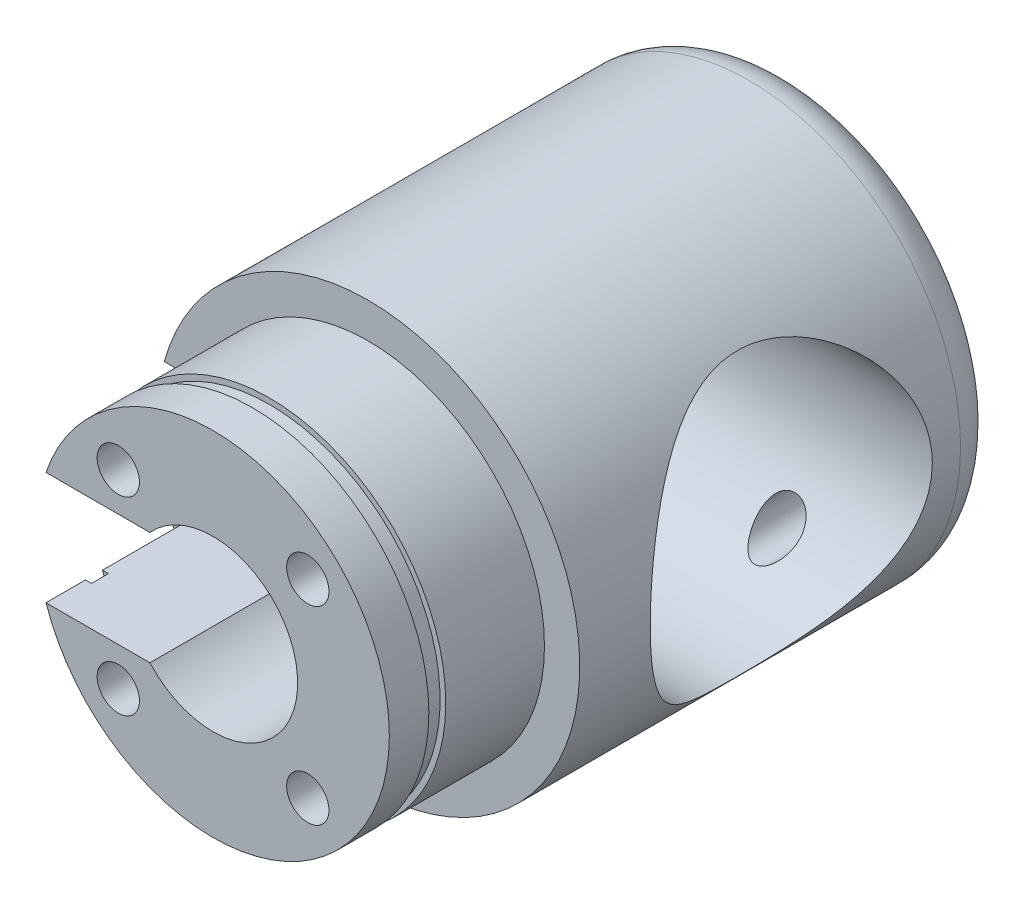
from build123d import *

# Parameters (mm, degrees)
SKETCH_1_R          = 12.5
EXTRUDE_1_DEPTH     = 8
SKETCH_2_R          = 15
EXTRUDE_2_DEPTH     = 30
SKETCH_3_R          = 10
CUT_EXTRUDE_1_DEPTH = 15
SKETCH_5_R          = 12.5
EXTRUDE_3_DEPTH     = 3
SKETCH_6_R          = 12.5
SKETCH_6_R_2        = 12.1
CUT_EXTRUDE_2_DEPTH = 1.2
EXTRUDE_START       = 2
SKETCH_9_R          = 15
SKETCH_9_R_2        = 12.5
EXTRUDE_4_DEPTH     = 2
SKETCH_12_R         = 1.5
CUT_EXTRUDE_6_DEPTH = 47.162755705
SKETCH_13_R         = 6
CUT_EXTRUDE_7_DEPTH = 20
SKETCH_14_W         = 23.536155202
SKETCH_14_H         = 8
CUT_EXTRUDE_8_DEPTH = 20
FILLET_1_R          = 3


with BuildPart() as part:
    # 草图1 → 凸台-拉伸1 (new body)
    with BuildSketch(Plane.XY):
        Circle(SKETCH_1_R)
    extrude(amount=EXTRUDE_1_DEPTH)

    # 草图2 → 凸台-拉伸2 (add)
    with BuildSketch(Plane(origin=(0, 0, 0), x_dir=(-1, 0, 0), z_dir=(0, 0, -1))):
        Circle(SKETCH_2_R)
    extrude(amount=EXTRUDE_2_DEPTH)

    # 草图3 → 切除-拉伸1 (cut, symmetric)
    with BuildSketch(Plane(origin=(0, 0, 0), x_dir=(0, 0, -1), z_dir=(1, 0, 0))):
        with Locations((15, 0)):
            Circle(SKETCH_3_R)
    extrude(amount=CUT_EXTRUDE_1_DEPTH, both=True, mode=Mode.SUBTRACT)

    # 草图5 → 凸台-拉伸3 (add)
    with BuildSketch(Plane.XY.offset(8)):
        Circle(SKETCH_5_R)
    extrude(amount=EXTRUDE_3_DEPTH)

    # 草图6 → 切除-拉伸2 (cut)
    with BuildSketch(Plane.XY.offset(7)):
        Circle(SKETCH_6_R)
        Circle(SKETCH_6_R_2, mode=Mode.SUBTRACT)
    extrude(amount=CUT_EXTRUDE_2_DEPTH, mode=Mode.SUBTRACT)

    # 草图9 → 凸台-拉伸4 (add)
    with BuildSketch(Plane(origin=(0, 0, 0), x_dir=(-1, 0, 0), z_dir=(0, 0, -1)).offset(EXTRUDE_START)):
        Circle(SKETCH_9_R)
        with Locations(Location((0, 0, 0), (0, 0, 180))):
            Circle(SKETCH_9_R_2, mode=Mode.SUBTRACT)
    extrude(amount=-EXTRUDE_4_DEPTH)

    # 草图12 → 切除-拉伸6 (cut, through all)
    with BuildSketch(Plane.XY.offset(11)):
        with Locations((6.717514421, 6.717514421)):
            Circle(SKETCH_12_R)
        with Locations((6.717514421, -6.717514421)):
            Circle(SKETCH_12_R)
        with Locations((-6.717514421, -6.717514421)):
            Circle(SKETCH_12_R)
        with Locations((-6.717514421, 6.717514421)):
            Circle(SKETCH_12_R)
    extrude(amount=-CUT_EXTRUDE_6_DEPTH, mode=Mode.SUBTRACT)

    # 草图13 → 切除-拉伸7 (cut)
    with BuildSketch(Plane.XY.offset(11)):
        Circle(SKETCH_13_R)
    extrude(amount=-CUT_EXTRUDE_7_DEPTH, mode=Mode.SUBTRACT)

    # 草图14 → 切除-拉伸8 (cut)
    with BuildSketch(Plane.XY.offset(11)):
        with Locations((-12.5, 0)):
            Rectangle(SKETCH_14_W, SKETCH_14_H)
    extrude(amount=-CUT_EXTRUDE_8_DEPTH, mode=Mode.SUBTRACT)

    # 圆角1
    fillet_1_edges = [part.edges().sort_by_distance(p)[0] for p in [
        (15, 0, -30),
    ]]
    fillet(fillet_1_edges, radius=FILLET_1_R)


solid = part.part
